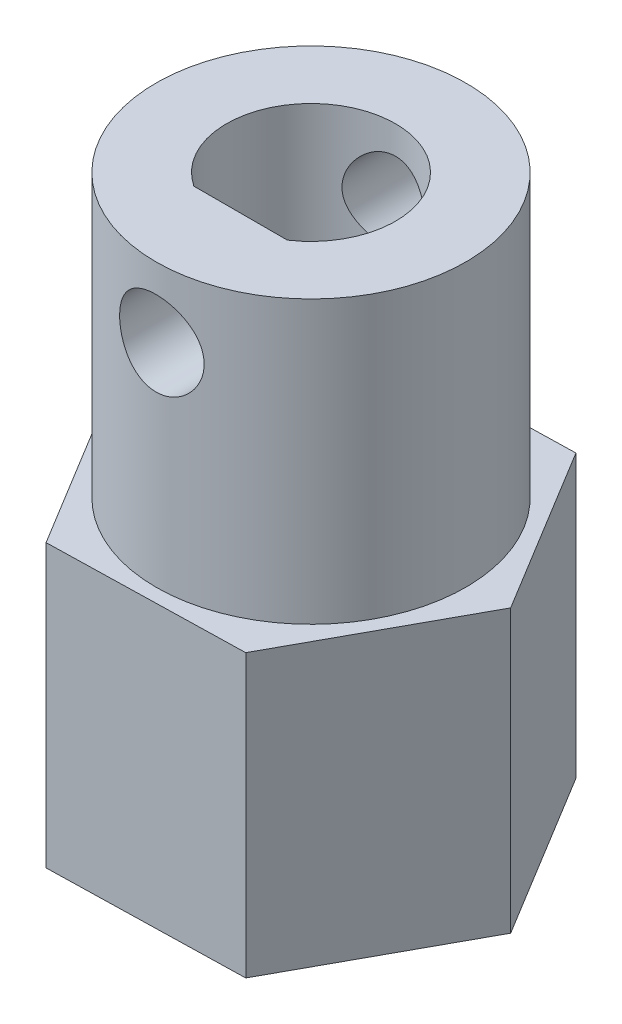
from build123d import *

# Parameters (mm, degrees)
EXTRUDE_1_DEPTH          = 10
SKETCH_2_R               = 5.5
EXTRUDE_2_DEPTH          = 10
CUT_EXTRUDE_1_DEPTH      = 11.5
CUT_EXTRUDE_3_DEPTH      = 23.837874147
CUT_EXTRUDE_3_DEPTH_BACK = 23.837874147
SKETCH_4_R               = 1.5
SKETCH_6_R               = 1.5
CUT_EXTRUDE_4_DEPTH      = 15.736856398


with BuildPart() as part:
    # 草图1 → 凸台-拉伸1 (new body)
    with BuildSketch(Plane(origin=(0, 0, 0), x_dir=(1, 0, 0), z_dir=(0, 1, 0))):
        Polygon((3.602298117, -5.918061192), (6.926340392, 0.160651085), (3.324042275, 6.078712278), (-3.602298117, 5.918061192), (-6.926340392, -0.160651085), (-3.324042275, -6.078712278), align=None)
    extrude(amount=EXTRUDE_1_DEPTH)

    # 草图2 → 凸台-拉伸2 (add)
    with BuildSketch(Plane(origin=(0, 10, 0), x_dir=(1, 0, 0), z_dir=(0, 1, 0))):
        with Locations(Location((0, 0, 0), (0, 0, 270))):
            Circle(SKETCH_2_R)
    extrude(amount=EXTRUDE_2_DEPTH)

    # 草图3 → 切除-拉伸1 (cut)
    with BuildSketch(Plane(origin=(0, 20, 0), x_dir=(1, 0, 0), z_dir=(0, 1, 0))):
        with BuildLine():
            Line((-1.658312395, -2.5), (1.658312395, -2.5))
            ThreePointArc((1.658312395, -2.5), (0, 3), (-1.658312395, -2.5))
        make_face()
    extrude(amount=-CUT_EXTRUDE_1_DEPTH, mode=Mode.SUBTRACT)

    # 草图4 → 切除-拉伸3 (cut, two sides: drawn at the far end of the back side and taken through both)
    with BuildSketch(Plane(origin=(0, 0, 2.5), x_dir=(-1, 0, 0), z_dir=(0, 0, -1)).offset(-CUT_EXTRUDE_3_DEPTH_BACK)):
        with Locations((0, 17.5)):
            Circle(SKETCH_4_R)
    extrude(amount=CUT_EXTRUDE_3_DEPTH + CUT_EXTRUDE_3_DEPTH_BACK, mode=Mode.SUBTRACT)

    # 草图6 → 切除-拉伸4 (cut, through all)
    with BuildSketch(Plane(origin=(0, 8.5, 0), x_dir=(1, 0, 0), z_dir=(0, 1, 0))):
        with Locations(Location((0, 0, 0), (0, 0, 270))):
            Circle(SKETCH_6_R)
    extrude(amount=-CUT_EXTRUDE_4_DEPTH, mode=Mode.SUBTRACT)


solid = part.part
